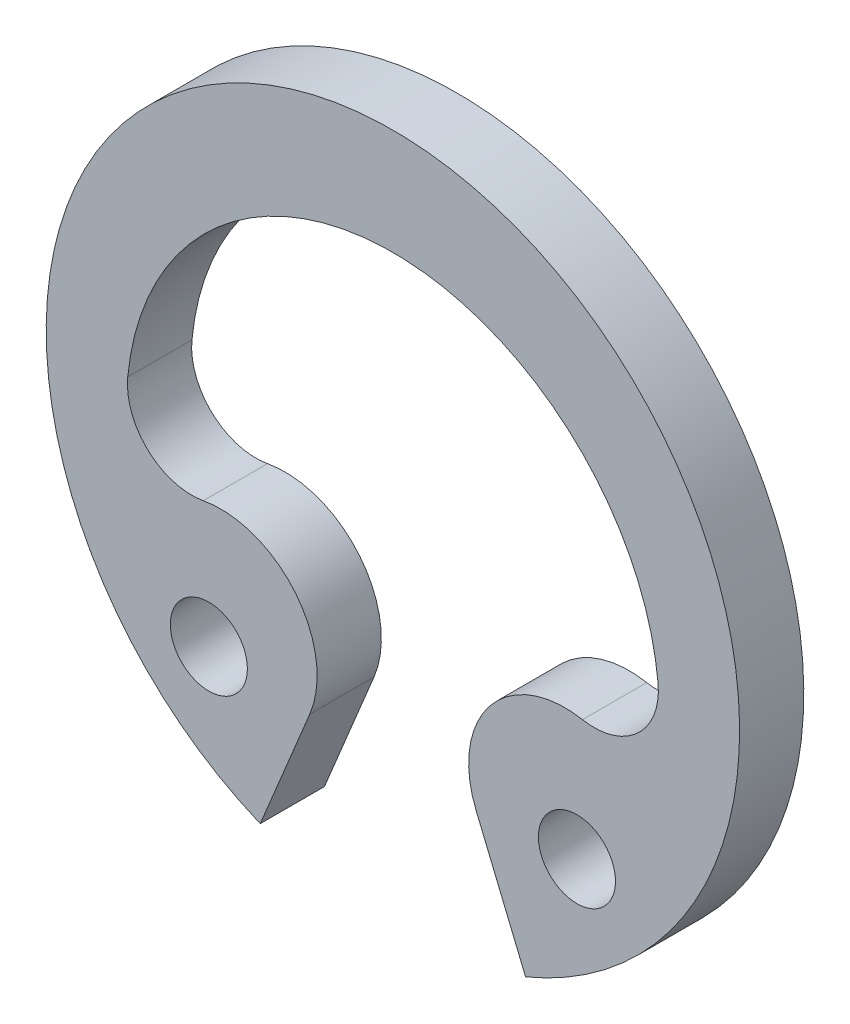
from build123d import *

# Parameters (mm, degrees)
SKETCH_1_R        = 0.6
EXTRUDE_886_DEPTH = 1


with BuildPart() as part:
    # 草图1 → Extrude 886 (new body)
    with BuildSketch(Plane.XY):
        with BuildLine():
            Line((-1.294352816, -3.124844122), (-2.066490535, -4.988949476))
            ThreePointArc((-2.066490535, -4.988949476), (0, 5.4), (2.066490535, -4.988949476))
            Line((2.066490535, -4.988949476), (1.294352816, -3.124844122))
            ThreePointArc((1.294352816, -3.124844122), (1.514299096, -1.607028687), (2.95304388, -1.075847449))
            ThreePointArc((2.95304388, -1.075847449), (3.811321469, -0.829101483), (4.130183275, 0.005075442))
            ThreePointArc((4.130183275, 0.005075442), (0, 3.75), (-4.130183275, 0.005075442))
            ThreePointArc((-4.130183275, 0.005075442), (-3.811321469, -0.829101483), (-2.95304388, -1.075847449))
            ThreePointArc((-2.95304388, -1.075847449), (-1.514299096, -1.607028687), (-1.294352816, -3.124844122))
        make_face()
        with Locations((-2.86658662, -3.000863401)):
            Circle(SKETCH_1_R, mode=Mode.SUBTRACT)
        with Locations(Location((2.86658662, -3.000863401, 0), (0, 0, 180))):
            Circle(SKETCH_1_R, mode=Mode.SUBTRACT)
    extrude(amount=EXTRUDE_886_DEPTH)


solid = part.part
